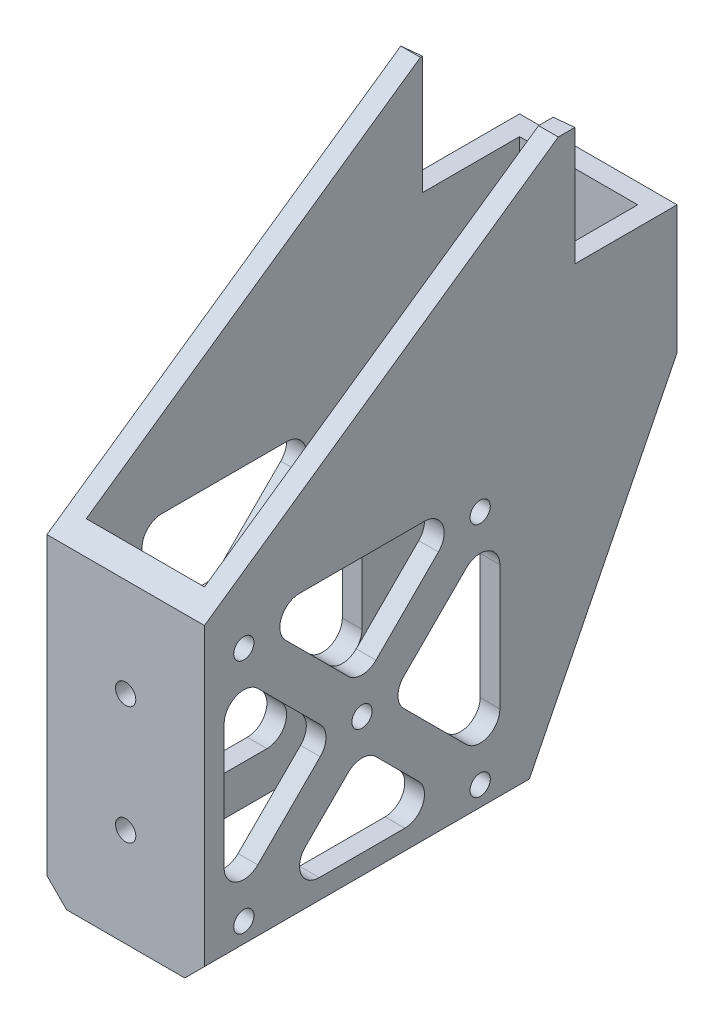
from build123d import *

# Parameters (mm, degrees)
SKETCH1_W                    = 25.4
SKETCH1_H                    = 76.2
SKETCH1_W_2                  = 19.05
SKETCH1_H_2                  = 69.85
BOSS_EXTRUDE1_DEPTH          = 90.4875
CUT_EXTRUDE1_DEPTH           = 19.05
CUT_EXTRUDE2_DEPTH           = 102.413794211
F_30_0_1285_DIAMETER_HOLE1_D = 3.2639
F_30_0_1285_DIAMETER_HOLE2_D = 3.2639
CHAMFER1_SIZE                = 3.175


with BuildPart() as part:
    # Sketch1 → Boss-Extrude1 (new body)
    with BuildSketch(Plane(origin=(0, 0, 0), x_dir=(1, 0, 0), z_dir=(0, 1, 0))):
        Rectangle(SKETCH1_W, SKETCH1_H)
        Rectangle(SKETCH1_W_2, SKETCH1_H_2, mode=Mode.SUBTRACT)
    extrude(amount=BOSS_EXTRUDE1_DEPTH)

    # Sketch2 → Cut-Extrude1 (cut)
    with BuildSketch(Plane(origin=(0, 90.4875, 0), x_dir=(1, 0, 0), z_dir=(0, 1, 0))):
        Polygon((-12.7, 18.94475058), (12.7, 21.618434791), (12.7, 38.1), (-12.7, 38.1), align=None)
    extrude(amount=-CUT_EXTRUDE1_DEPTH, mode=Mode.SUBTRACT)

    # Sketch3 → Cut-Extrude2 (cut, through all)
    with BuildSketch(Plane.ZY.offset(12.7)):
        Polygon((38.1, 90.4875), (-18.94475058, 90.4875), (38.1, 50.8), align=None)
        Polygon((-38.1, 0), (-12.7, 0), (-38.1, 50.8), align=None)
        with BuildLine():
            Line((5.964807909, 27.64506403), (-4.10493597, 37.714807909))
            ThreePointArc((-4.10493597, 37.714807909), (-7.565019898, 38.403061395), (-9.525, 35.469743879))
            Line((-9.525, 35.469743879), (-9.525, 15.330256121))
            ThreePointArc((-9.525, 15.330256121), (-7.565019898, 12.396938605), (-4.10493597, 13.085192091))
            Line((-4.10493597, 13.085192091), (5.964807909, 23.15493597))
            ThreePointArc((5.964807909, 23.15493597), (6.894743879, 25.4), (5.964807909, 27.64506403))
        make_face()
        with BuildLine():
            ThreePointArc((2.630256121, 47.625), (-0.303061395, 45.665019898), (0.385192091, 42.20493597))
            Line((0.385192091, 42.20493597), (10.45493597, 32.135192091))
            ThreePointArc((10.45493597, 32.135192091), (12.7, 31.205256121), (14.94506403, 32.135192091))
            Line((14.94506403, 32.135192091), (25.014807909, 42.20493597))
            ThreePointArc((25.014807909, 42.20493597), (25.703061395, 45.665019898), (22.769743879, 47.625))
            Line((22.769743879, 47.625), (2.630256121, 47.625))
        make_face()
        with BuildLine():
            ThreePointArc((3.560192091, 11.77006403), (2.871938605, 8.309980102), (5.805256121, 6.35))
            Line((5.805256121, 6.35), (19.594743879, 6.35))
            ThreePointArc((19.594743879, 6.35), (22.528061395, 8.309980102), (21.839807909, 11.77006403))
            Line((21.839807909, 11.77006403), (14.94506403, 18.664807909))
            ThreePointArc((14.94506403, 18.664807909), (12.7, 19.594743879), (10.45493597, 18.664807909))
            Line((10.45493597, 18.664807909), (3.560192091, 11.77006403))
        make_face()
        with BuildLine():
            ThreePointArc((29.50493597, 13.085192091), (32.965019898, 12.396938605), (34.925, 15.330256121))
            Line((34.925, 15.330256121), (34.925, 35.469743879))
            ThreePointArc((34.925, 35.469743879), (32.965019898, 38.403061395), (29.50493597, 37.714807909))
            Line((29.50493597, 37.714807909), (19.435192091, 27.64506403))
            ThreePointArc((19.435192091, 27.64506403), (18.505256121, 25.4), (19.435192091, 23.15493597))
            Line((19.435192091, 23.15493597), (29.50493597, 13.085192091))
        make_face()
    extrude(amount=-CUT_EXTRUDE2_DEPTH, mode=Mode.SUBTRACT)

    # #30 (0.1285) Diameter Hole1 (through all)
    with Locations(Plane.ZY.offset(12.7)):
        with Locations((-6.35, 44.45), (12.7, 25.4), (31.75, 44.45), (31.75, 6.35), (-6.35, 6.35)):
            Hole(F_30_0_1285_DIAMETER_HOLE1_D / 2)

    # #30 (0.1285) Diameter Hole2 (through all)
    with Locations(Plane.XY.offset(38.1)):
        with Locations((0, 34.925), (0, 15.875)):
            Hole(F_30_0_1285_DIAMETER_HOLE2_D / 2)

    # Chamfer1
    chamfer1_edges = [part.edges().sort_by_distance(p)[0] for p in [
        (12.7, 0, 12.7),
        (-12.7, 0, 12.7),
    ]]
    chamfer(chamfer1_edges, length=CHAMFER1_SIZE)


solid = part.part
